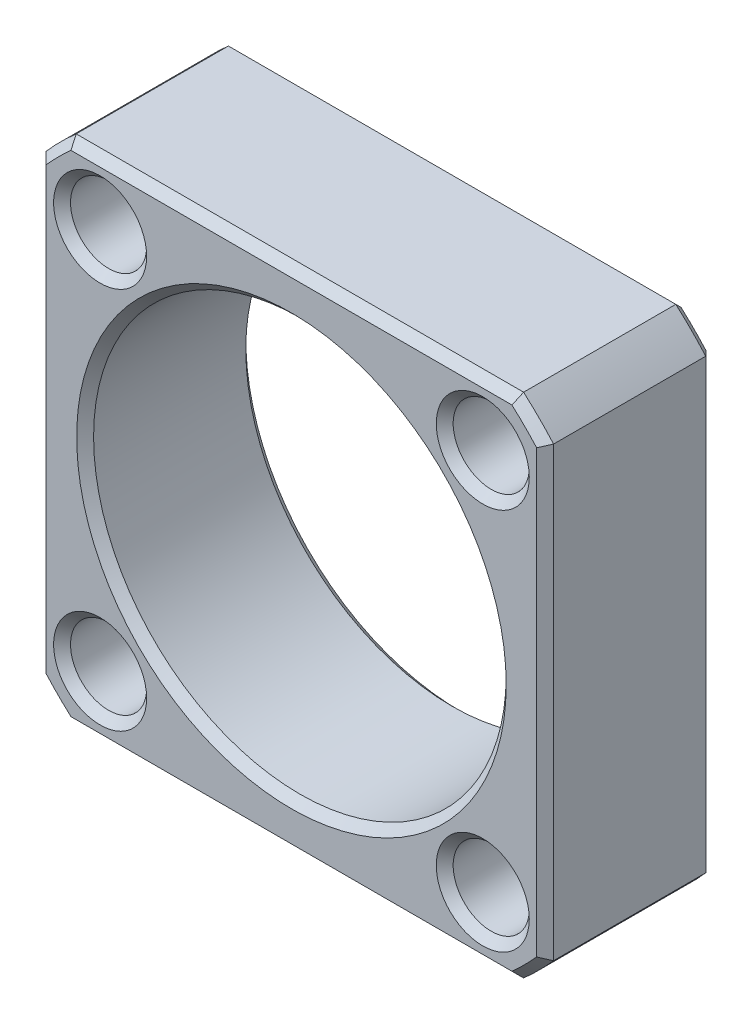
from build123d import *

# Parameters (mm, degrees)
SKETCH1_R           = 2.25
BOSS_EXTRUDE1_DEPTH = 10
SKETCH2_R           = 12.2
CUT_EXTRUDE3_DEPTH  = 24.452078799
CHAMFER1_SIZE       = 0.5


with BuildPart() as part:
    # Sketch1 → Boss-Extrude1 (new body)
    with BuildSketch(Plane.XY):
        with BuildLine():
            Line((-13.228756555, 15), (13.228756555, 15))
            ThreePointArc((13.228756555, 15), (14.142135624, 14.142135624), (15, 13.228756555))
            Line((15, 13.228756555), (15, -13.228756555))
            ThreePointArc((15, -13.228756555), (14.142135624, -14.142135624), (13.228756555, -15))
            Line((13.228756555, -15), (-13.228756555, -15))
            ThreePointArc((-13.228756555, -15), (-14.142135624, -14.142135624), (-15, -13.228756555))
            Line((-15, -13.228756555), (-15, 13.228756555))
            ThreePointArc((-15, 13.228756555), (-14.142135624, 14.142135624), (-13.228756555, 15))
        make_face()
        with Locations((-11.313708499, 11.313708499)):
            Circle(SKETCH1_R, mode=Mode.SUBTRACT)
        with Locations((11.313708499, 11.313708499)):
            Circle(SKETCH1_R, mode=Mode.SUBTRACT)
        with Locations((11.313708499, -11.313708499)):
            Circle(SKETCH1_R, mode=Mode.SUBTRACT)
        with Locations((-11.313708499, -11.313708499)):
            Circle(SKETCH1_R, mode=Mode.SUBTRACT)
    extrude(amount=BOSS_EXTRUDE1_DEPTH)

    # Sketch2 → Cut-Extrude3 (cut, through all)
    with BuildSketch(Plane.XY.offset(10)):
        Circle(SKETCH2_R)
    extrude(amount=-CUT_EXTRUDE3_DEPTH, mode=Mode.SUBTRACT)

    # Chamfer1
    chamfer1_edges = [part.edges().sort_by_distance(p)[0] for p in [
        (-14.142135624, -14.142135624, 10),
        (-15, 0, 0),
        (-14.142135624, 14.142135624, 0),
        (0, -15, 10),
        (14.142135624, -14.142135624, 10),
        (15, 0, 10),
        (-13.563708499, 11.313708499, 0),
        (-13.563708499, 11.313708499, 10),
        (14.142135624, 14.142135624, 10),
        (9.063708499, 11.313708499, 0),
        (9.063708499, 11.313708499, 10),
        (0, 15, 10),
        (9.063708499, -11.313708499, 0),
        (9.063708499, -11.313708499, 10),
        (-13.563708499, -11.313708499, 0),
        (-13.563708499, -11.313708499, 10),
        (-14.142135624, 14.142135624, 10),
        (-12.2, 0, 0),
        (-12.2, 0, 10),
        (-15, 0, 10),
        (0, 15, 0),
        (14.142135624, 14.142135624, 0),
        (15, 0, 0),
        (14.142135624, -14.142135624, 0),
        (0, -15, 0),
        (-14.142135624, -14.142135624, 0),
    ]]
    chamfer(chamfer1_edges, length=CHAMFER1_SIZE)


solid = part.part
